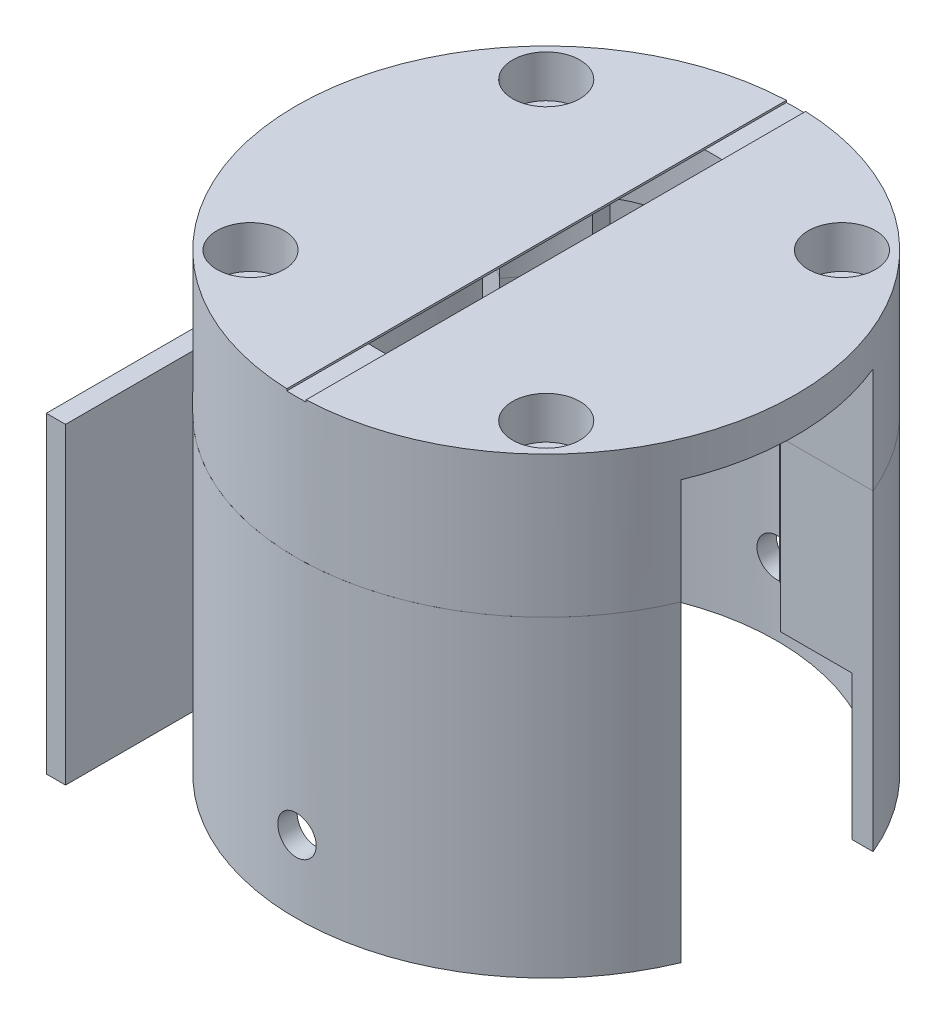
from build123d import *
from build123d.topology import SkipClean

# Parameters (mm, degrees)
SKETCH1_R                                           = 26
BOSS_EXTRUDE1_DEPTH                                 = 47
SKETCH2_R                                           = 17.5
CUT_EXTRUDE1_DEPTH                                  = 32
SKETCH3_R                                           = 24
CUT_EXTRUDE2_DEPTH                                  = 49.744230428
SKETCH11_W                                          = 20
SKETCH11_H                                          = 43.5
CUT_EXTRUDE3_DEPTH                                  = 15
SKETCH12_R                                          = 26
BOSS_EXTRUDE2_DEPTH                                 = 0.2
SKETCH26_W                                          = 2
SKETCH26_H                                          = 52
BOSS_EXTRUDE4_DEPTH                                 = 32.5
CIRPATTERN1_COUNT                                   = 4
CUT_EXTRUDE5_DEPTH                                  = 60.831764313
CUT_EXTRUDE5_DEPTH_BACK                             = 60.831764313
SKETCH35_W                                          = 2
SKETCH35_H                                          = 0.2
CBORE_FOR_M4_HEX_SOCKET_HEAD_CAP_SCREW2_D           = 4
CBORE_FOR_M4_HEX_SOCKET_HEAD_CAP_SCREW2_CBORE_D     = 7
CBORE_FOR_M4_HEX_SOCKET_HEAD_CAP_SCREW2_CBORE_DEPTH = 4.4
CIRPATTERN2_COUNT                                   = 4
CUT_EXTRUDE6_START                                  = -25
CUT_EXTRUDE6_DEPTH                                  = 25


with BuildPart() as part:
    # Sketch1 → Boss-Extrude1 (new body)
    with BuildSketch(Plane(origin=(0, 0, 0), x_dir=(1, 0, 0), z_dir=(0, 1, 0))):
        with Locations(Location((0, 0, 0), (0, 0, 270))):
            Circle(SKETCH1_R)
    extrude(amount=BOSS_EXTRUDE1_DEPTH)

    # Sketch2 → Cut-Extrude1 (cut)
    with BuildSketch(Plane(origin=(0, 47, 0), x_dir=(1, 0, 0), z_dir=(0, 1, 0))):
        with Locations(Location((0, 0, 0), (0, 0, 270))):
            Circle(SKETCH2_R)
    extrude(amount=-CUT_EXTRUDE1_DEPTH, mode=Mode.SUBTRACT)

    # Sketch3 → Cut-Extrude2 (cut, through all)
    with BuildSketch(Plane(origin=(0, 15, 0), x_dir=(1, 0, 0), z_dir=(0, 1, 0))):
        with Locations(Location((0, 0, 0), (0, 0, 270))):
            Circle(SKETCH3_R)
    extrude(amount=-CUT_EXTRUDE2_DEPTH, mode=Mode.SUBTRACT)

    # Sketch11 → Cut-Extrude3 (cut)
    with BuildSketch(Plane(origin=(26, 0, 0), x_dir=(0, 0, -1), z_dir=(1, 0, 0))):
        with Locations((0, 21.75)):
            Rectangle(SKETCH11_W, SKETCH11_H)
    extrude(amount=-CUT_EXTRUDE3_DEPTH, mode=Mode.SUBTRACT)

    # Sketch12 → Boss-Extrude2 (add)
    with BuildSketch(Plane(origin=(0, 47, 0), x_dir=(1, 0, 0), z_dir=(0, 1, 0))):
        with Locations(Location((0, 0, 0), (0, 0, 22.619864948))):
            Circle(SKETCH12_R)
    extrude(amount=BOSS_EXTRUDE2_DEPTH)

    # Sketch26 → Boss-Extrude4 (add)
    with BuildSketch(Plane.XZ):
        with Locations((-25, 0)):
            Rectangle(SKETCH26_W, SKETCH26_H)
    extrude(amount=-BOSS_EXTRUDE4_DEPTH)

    # Sketch5 → Ø4.0mm Dowel Hole1 (revolve, cut)
    with BuildSketch(Plane(origin=(26, 7.5, 0), x_dir=(0, 0, -1), z_dir=(0, 1, 0))):
        Polygon((0, 0), (0, 53.201721238), (2, 52), (2, 0), align=None)
    f_4_0mm_dowel_hole1 = revolve(axis=Axis((32.35, 7.5, 0), (-1, 0, 0)), mode=Mode.SUBTRACT)

    # CirPattern1: Ø4.0mm Dowel Hole1 ×4 about axis
    cirpattern1_axis = Axis((0, 0, 0), (0, 1, 0))
    for i in range(1, CIRPATTERN1_COUNT):
        add(f_4_0mm_dowel_hole1.rotate(cirpattern1_axis, i * 360 / CIRPATTERN1_COUNT), mode=Mode.SUBTRACT)

    # Sketch35 → Cut-Extrude5 (cut, two sides: drawn at the far end of the back side and taken through both)
    with BuildSketch(Plane.XY.offset(-CUT_EXTRUDE5_DEPTH_BACK)):
        with Locations((0, 47.1)):
            Rectangle(SKETCH35_W, SKETCH35_H)
    extrude(amount=CUT_EXTRUDE5_DEPTH + CUT_EXTRUDE5_DEPTH_BACK, mode=Mode.SUBTRACT)

    # CBORE for M4 Hex Socket Head Cap Screw2 (through all)
    with Locations(Plane(origin=(0, 47.2, 0), x_dir=(1, 0, 0), z_dir=(0, 1, 0))):
        with Locations((-15.379572491, 15.379572491)):
            cbore_for_m4_hex_socket_head_cap_screw2 = CounterBoreHole(CBORE_FOR_M4_HEX_SOCKET_HEAD_CAP_SCREW2_D / 2, CBORE_FOR_M4_HEX_SOCKET_HEAD_CAP_SCREW2_CBORE_D / 2, CBORE_FOR_M4_HEX_SOCKET_HEAD_CAP_SCREW2_CBORE_DEPTH)

    # CirPattern2: CBORE for M4 Hex Socket Head Cap Screw2 ×4 about axis
    cirpattern2_axis = Axis((0, 0, 0), (0, 1, 0))
    for i in range(1, CIRPATTERN2_COUNT):
        add(cbore_for_m4_hex_socket_head_cap_screw2.rotate(cirpattern2_axis, i * 360 / CIRPATTERN2_COUNT), mode=Mode.SUBTRACT)

    # Sketch41 → Cut-Extrude6 (cut)
    with SkipClean():  # the faces are left unmerged after this step: merging them gives an invalid solid
        with BuildSketch(Plane.XZ.offset(-15).offset(CUT_EXTRUDE6_START)):
            with BuildLine():
                Line((-9.717729156, 14.553890891), (-13.327171414, 19.959621793))
                ThreePointArc((-13.327171414, 19.959621793), (1e-09, 24), (13.327171415, 19.959621792))
                Line((13.327171415, 19.959621792), (9.717729157, 14.55389089))
                ThreePointArc((9.717729157, 14.55389089), (1e-09, 17.5), (-9.717729156, 14.553890891))
            make_face()
            with BuildLine():
                Line((-9.717810502, -14.553836575), (-13.327282975, -19.959547302))
                ThreePointArc((-13.327282975, -19.959547302), (-6.7072e-05, -24), (13.327171414, -19.959621793))
                Line((13.327171414, -19.959621793), (9.717729156, -14.553890891))
                ThreePointArc((9.717729156, -14.553890891), (-4.8907e-05, -17.5), (-9.717810502, -14.553836575))
            make_face()
            with BuildLine():
                Line((-14.55389089, -9.717729157), (-19.959621792, -13.327171415))
                ThreePointArc((-19.959621792, -13.327171415), (-24, -1e-09), (-19.959621793, 13.327171414))
                Line((-19.959621793, 13.327171414), (-14.553890891, 9.717729156))
                ThreePointArc((-14.553890891, 9.717729156), (-17.5, -1e-09), (-14.55389089, -9.717729157))
            make_face()
        extrude(amount=CUT_EXTRUDE6_DEPTH, mode=Mode.SUBTRACT)


with BuildPart() as body_2:
    # Split2: the piece on the far side of the plane
    add(part.part)
    split(bisect_by=Plane.ZX.offset(32.5), keep=Keep.BOTTOM)


with BuildPart() as part_1:
    add(part.part)

    # Split2
    split(bisect_by=Plane.ZX.offset(32.5), keep=Keep.TOP)


solid = Compound([body_2.part, part_1.part])
